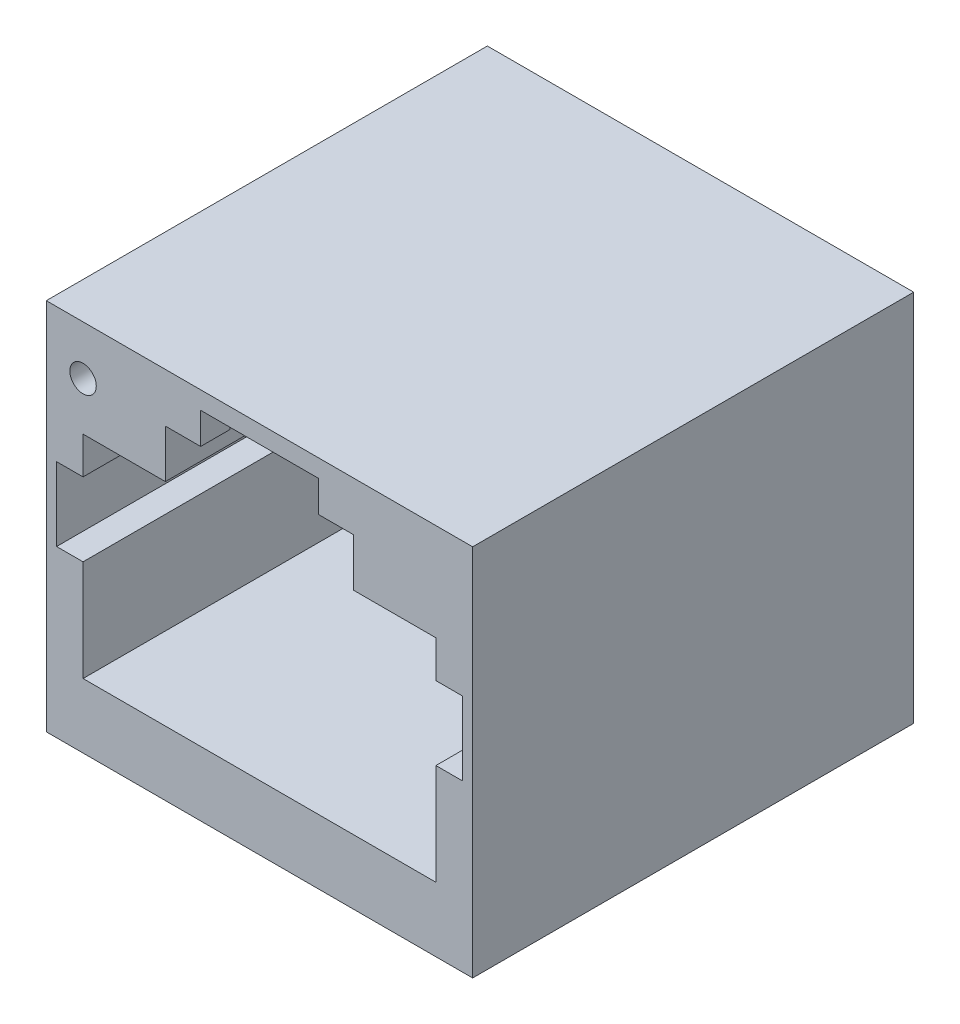
from build123d import *

# Parameters (mm, degrees)
SKETCH2_W               = 14.5
SKETCH2_H               = 15
OUTLINE_EXTRUSION_DEPTH = 12.7
SKETCH3_W               = 12
SKETCH3_H               = 7.2
SKETCH3_W_2             = 4
SKETCH3_H_2             = 1.06471969
SKETCH3_W_3             = 0.9
SKETCH3_H_3             = 2.5
CUT_EXTRUDE1_DEPTH      = 14
SKETCH5_R               = 0.45
CUT_EXTRUDE2_DEPTH      = 14
SKETCH6_W               = 4
SKETCH6_H               = 0.1
BOSS_EXTRUDE1_DEPTH     = 11.5
SKETCH7_W               = 1.2
SKETCH7_H               = 0.96471969
CUT_EXTRUDE3_DEPTH      = 13


with BuildPart() as part:
    # Sketch2 → Outline extrusion (new body)
    with BuildSketch(Plane(origin=(0, 0, 0), x_dir=(1, 0, 0), z_dir=(0, 1, 0))):
        Rectangle(SKETCH2_W, SKETCH2_H)
    extrude(amount=OUTLINE_EXTRUSION_DEPTH)

    # Sketch3 → Cut-Extrude1 (cut)
    with BuildSketch(Plane.XY.offset(7.5)):
        with Locations((0, 5.795210166)):
            Rectangle(SKETCH3_W, SKETCH3_H)
        Polygon((-3.2, 11.030490476), (-3.2, 9.395210166), (3.2, 9.395210166), (3.2, 11.030490476), (2, 11.030490476), (-2, 11.030490476), align=None)
        with Locations((0, 11.562850321)):
            Rectangle(SKETCH3_W_2, SKETCH3_H_2)
        with Locations((6.45, 6.883168125)):
            Rectangle(SKETCH3_W_3, SKETCH3_H_3)
        with Locations((-6.45, 6.883168125)):
            Rectangle(SKETCH3_W_3, SKETCH3_H_3)
    extrude(amount=-CUT_EXTRUDE1_DEPTH, mode=Mode.SUBTRACT)

    # Sketch5 → Cut-Extrude2 (cut)
    with BuildSketch(Plane.XY.offset(7.5)):
        with Locations((-6, 11.030490476)):
            Circle(SKETCH5_R)
    extrude(amount=-CUT_EXTRUDE2_DEPTH, mode=Mode.SUBTRACT)

    # Sketch6 → Boss-Extrude1 (add)
    with BuildSketch(Plane.XY.offset(-6.5)):
        with Locations((0, 12.045210166)):
            Rectangle(SKETCH6_W, SKETCH6_H)
    extrude(amount=BOSS_EXTRUDE1_DEPTH)

    # Sketch7 → Cut-Extrude3 (cut)
    with BuildSketch(Plane.XY.offset(-6.5)):
        with Locations((-2.6, 11.512850321)):
            Rectangle(SKETCH7_W, SKETCH7_H)
        with Locations((2.6, 11.512850321)):
            Rectangle(SKETCH7_W, SKETCH7_H)
    extrude(amount=CUT_EXTRUDE3_DEPTH, mode=Mode.SUBTRACT)


solid = part.part
